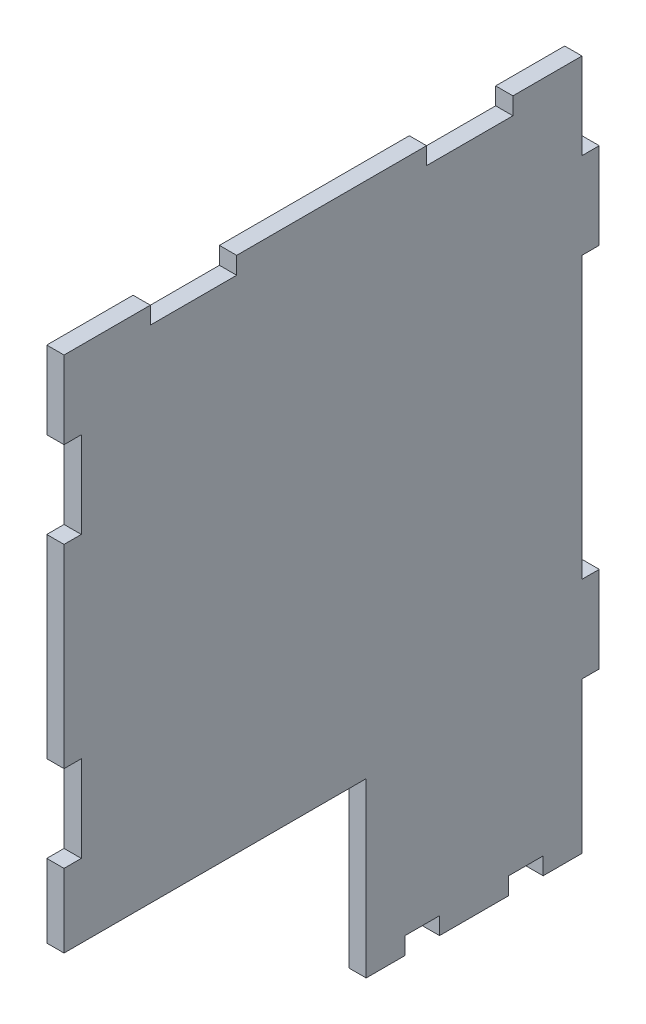
from build123d import *

# Parameters (mm, degrees)
SKETCH1_W           = 5.08
SKETCH1_H           = 203.2
BOSS_EXTRUDE1_DEPTH = 152.4
SKETCH2_W           = 88.9
SKETCH2_H           = 50.8
CUT_EXTRUDE1_DEPTH  = 5.08
SKETCH3_W           = 5.08
SKETCH3_H           = 10.16
CUT_EXTRUDE2_DEPTH  = 5.08
SKETCH5_W           = 5.08
SKETCH5_H           = 25.4
BOSS_EXTRUDE2_DEPTH = 5.08
SKETCH6_W           = 25.4
SKETCH6_H           = 5.08
SKETCH6_W_2         = 5.08
SKETCH6_H_2         = 25.4
CUT_EXTRUDE3_DEPTH  = 5.08


with BuildPart() as part:
    # Sketch1 → Boss-Extrude1 (new body)
    with BuildSketch(Plane.XY):
        with Locations((-99.06, 0)):
            Rectangle(SKETCH1_W, SKETCH1_H)
    extrude(amount=BOSS_EXTRUDE1_DEPTH)

    # Sketch2 → Cut-Extrude1 (cut)
    with BuildSketch(Plane.ZY.offset(101.6)):
        with Locations((107.95, -76.2)):
            Rectangle(SKETCH2_W, SKETCH2_H)
    extrude(amount=-CUT_EXTRUDE1_DEPTH, mode=Mode.SUBTRACT)

    # Sketch3 → Cut-Extrude2 (cut)
    with BuildSketch(Plane.XZ.offset(101.6)):
        with Locations((-99.06, 46.99)):
            Rectangle(SKETCH3_W, SKETCH3_H)
        with Locations((-99.06, 16.51)):
            Rectangle(SKETCH3_W, SKETCH3_H)
    extrude(amount=-CUT_EXTRUDE2_DEPTH, mode=Mode.SUBTRACT)

    # Sketch5 → Boss-Extrude2 (add)
    with BuildSketch(Plane(origin=(0, 0, 0), x_dir=(-1, 0, 0), z_dir=(0, 0, -1))):
        with Locations((99.06, -44.45)):
            Rectangle(SKETCH5_W, SKETCH5_H)
        with Locations((99.06, 63.5)):
            Rectangle(SKETCH5_W, SKETCH5_H)
    extrude(amount=BOSS_EXTRUDE2_DEPTH)

    # Sketch6 → Cut-Extrude3 (cut)
    with BuildSketch(Plane(origin=(-96.52, 0, 0), x_dir=(0, 0, -1), z_dir=(1, 0, 0))):
        with Locations((-114.3, 99.06)):
            Rectangle(SKETCH6_W, SKETCH6_H)
        with Locations((-33.02, 99.06)):
            Rectangle(SKETCH6_W, SKETCH6_H)
        with Locations((-149.86, 66.04)):
            Rectangle(SKETCH6_W_2, SKETCH6_H_2)
        with Locations((-149.86, -16.51)):
            Rectangle(SKETCH6_W_2, SKETCH6_H_2)
    extrude(amount=-CUT_EXTRUDE3_DEPTH, mode=Mode.SUBTRACT)


solid = part.part
